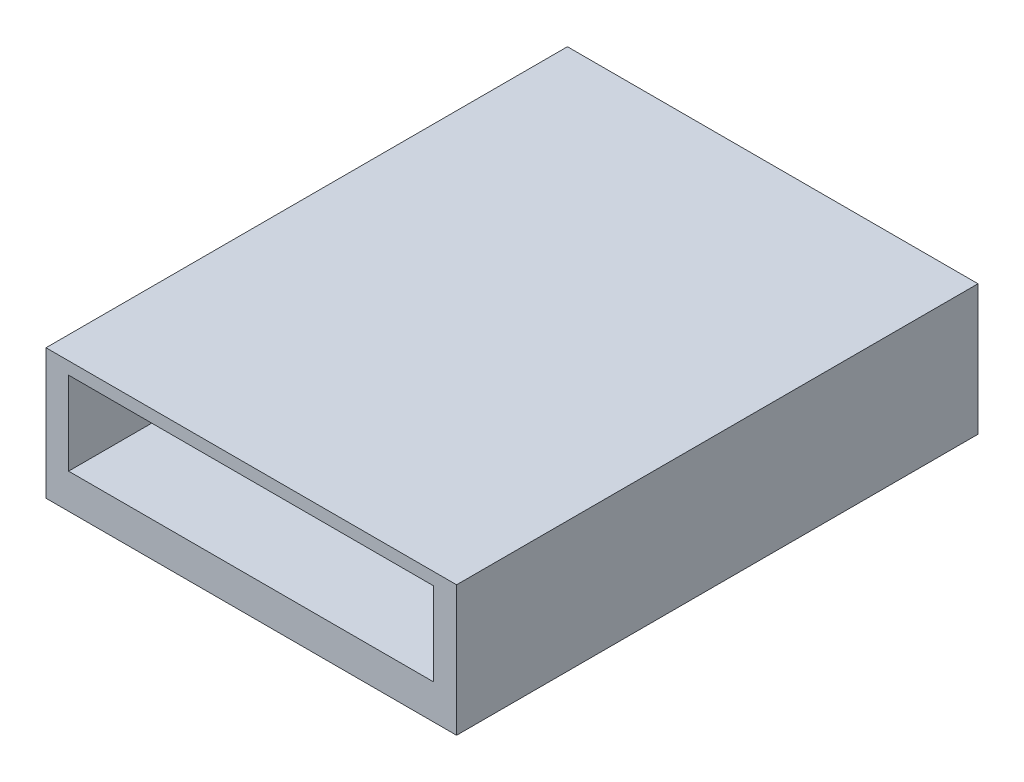
from build123d import *

# Parameters (mm, degrees)
SKETCH1_W           = 12
SKETCH1_H           = 3.81
BOSS_EXTRUDE1_DEPTH = 15.24
SKETCH2_W           = 10.668
SKETCH2_H           = 2.430992268
CUT_EXTRUDE1_DEPTH  = 12.7


with BuildPart() as part:
    # Sketch1 → Boss-Extrude1 (new body)
    with BuildSketch(Plane.XY):
        with Locations((6, 1.905)):
            Rectangle(SKETCH1_W, SKETCH1_H)
    extrude(amount=-BOSS_EXTRUDE1_DEPTH)

    # Sketch2 → Cut-Extrude1 (cut)
    with BuildSketch(Plane.XY):
        with Locations((5.9944, 2.231496134)):
            Rectangle(SKETCH2_W, SKETCH2_H)
    extrude(amount=-CUT_EXTRUDE1_DEPTH, mode=Mode.SUBTRACT)


solid = part.part
